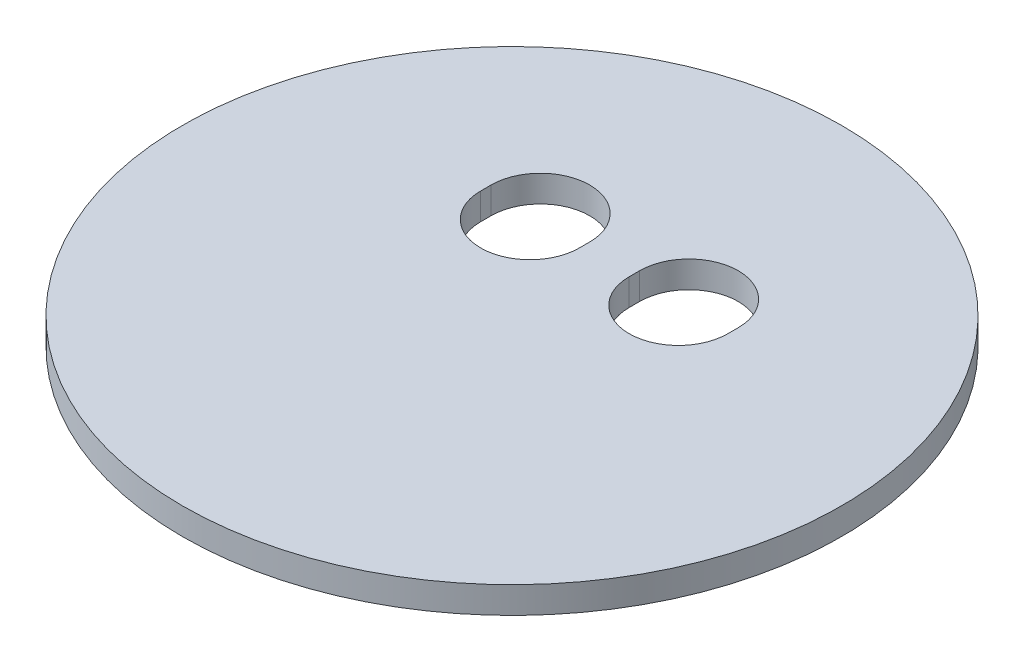
from build123d import *

# Parameters (mm, degrees)
SKETCH1_R           = 12.36
BOSS_EXTRUDE1_DEPTH = 1
CUT_EXTRUDE1_DEPTH  = 18.508260907


with BuildPart() as part:
    # Sketch1 → Boss-Extrude1 (new body)
    with BuildSketch(Plane(origin=(0, 0, 0), x_dir=(1, 0, 0), z_dir=(0, 1, 0))):
        with Locations(Location((0, 0, 0), (0, 0, 270))):
            Circle(SKETCH1_R)
    extrude(amount=BOSS_EXTRUDE1_DEPTH)

    # Sketch2 → Cut-Extrude1 (cut, through all)
    with BuildSketch(Plane(origin=(0, 1, 0), x_dir=(1, 0, 0), z_dir=(0, 1, 0))):
        with BuildLine():
            Line((4.635, 3.85), (4.635, 3.46))
            ThreePointArc((4.635, 3.46), (2.785, 1.61), (0.935, 3.46))
            Line((0.935, 3.46), (0.935, 3.85))
            ThreePointArc((0.935, 3.85), (2.785, 5.7), (4.635, 3.85))
        make_face()
        with BuildLine():
            Line((-0.935, 3.85), (-0.935, 3.46))
            ThreePointArc((-0.935, 3.46), (-2.785, 1.61), (-4.635, 3.46))
            Line((-4.635, 3.46), (-4.635, 3.85))
            ThreePointArc((-4.635, 3.85), (-2.785, 5.7), (-0.935, 3.85))
        make_face()
    extrude(amount=-CUT_EXTRUDE1_DEPTH, mode=Mode.SUBTRACT)


solid = part.part
